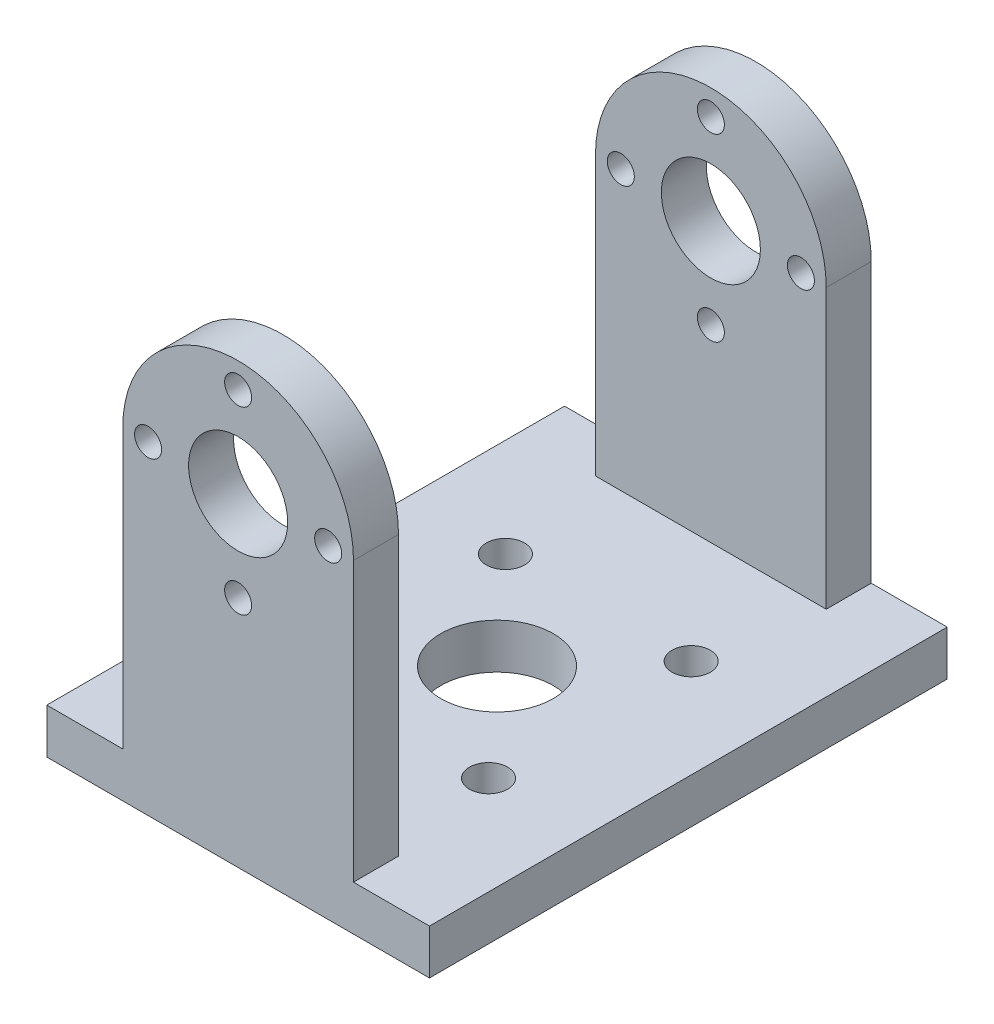
from build123d import *

# Parameters (mm, degrees)
SKETCH1_R           = 1.2
SKETCH1_R_2         = 4.4
BOSS_EXTRUDE1_DEPTH = 4
SKETCH3_W           = 34
SKETCH3_H           = 46
SKETCH3_R           = 5
SKETCH3_R_2         = 1.7
BOSS_EXTRUDE3_DEPTH = 4


with BuildPart() as part:
    # Sketch1 → Boss-Extrude1 (new body)
    with BuildSketch(Plane.XY):
        with BuildLine():
            Line((-10.25, -28.75), (10.25, -28.75))
            Line((10.25, -28.75), (10.25, 0))
            ThreePointArc((10.25, 0), (0, 10.25), (-10.25, 0))
            Line((-10.25, 0), (-10.25, -28.75))
        make_face()
        with Locations((0, 8)):
            Circle(SKETCH1_R, mode=Mode.SUBTRACT)
        with Locations((-8, 0)):
            Circle(SKETCH1_R, mode=Mode.SUBTRACT)
        with Locations((0, -8)):
            Circle(SKETCH1_R, mode=Mode.SUBTRACT)
        with Locations((8, 0)):
            Circle(SKETCH1_R, mode=Mode.SUBTRACT)
        Circle(SKETCH1_R_2, mode=Mode.SUBTRACT)
    boss_extrude1 = extrude(amount=BOSS_EXTRUDE1_DEPTH)

    # Sketch3 → Boss-Extrude3 (add)
    with BuildSketch(Plane(origin=(0, -28.75, 0), x_dir=(-1, 0, 0), z_dir=(0, -1, 0))):
        with Locations((0, -23)):
            Rectangle(SKETCH3_W, SKETCH3_H)
        with Locations(Location((0, -23, 0), (0, 0, 180))):
            Circle(SKETCH3_R, mode=Mode.SUBTRACT)
        with Locations(Location((-8.25, -14, 0), (0, 0, 180))):
            Circle(SKETCH3_R_2, mode=Mode.SUBTRACT)
        with Locations(Location((8.25, -14, 0), (0, 0, 180))):
            Circle(SKETCH3_R_2, mode=Mode.SUBTRACT)
        with Locations(Location((8.25, -32, 0), (0, 0, 180))):
            Circle(SKETCH3_R_2, mode=Mode.SUBTRACT)
        with Locations(Location((-8.25, -32, 0), (0, 0, 180))):
            Circle(SKETCH3_R_2, mode=Mode.SUBTRACT)
    extrude(amount=-BOSS_EXTRUDE3_DEPTH)

    # Mirror1: Boss-Extrude1 across plane
    add(boss_extrude1.mirror(Plane.XY.offset(23)))


solid = part.part
